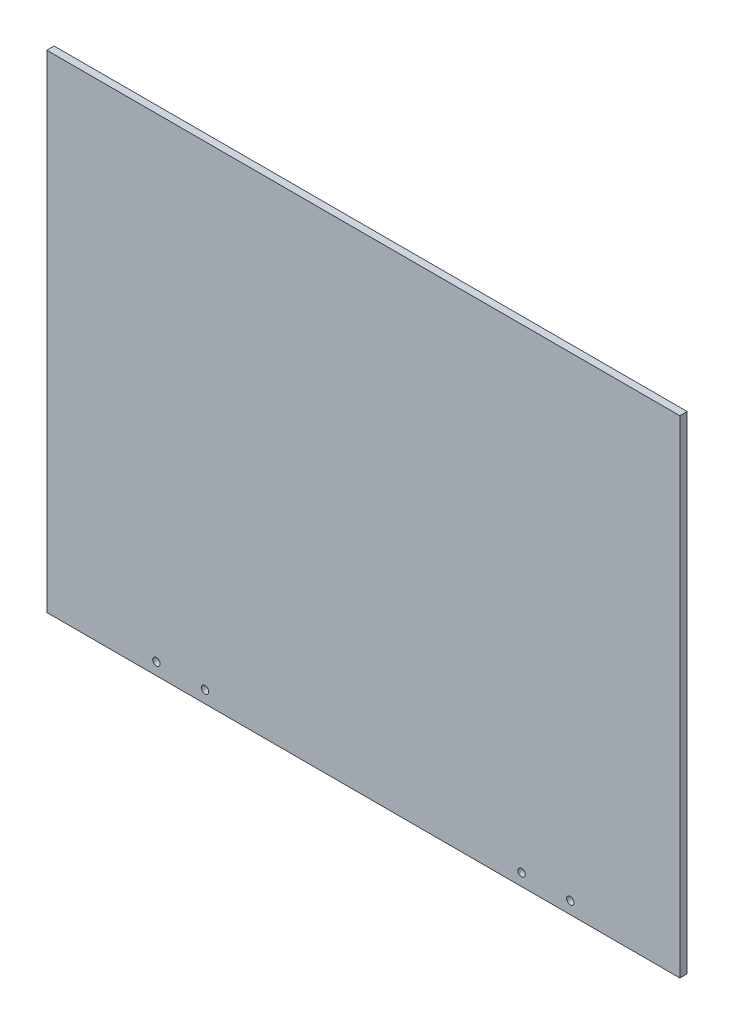
from build123d import *

# Parameters (mm, degrees)
SKETCH1_W               = 260
SKETCH1_H               = 200
BOSS_EXTRUDE1_DEPTH     = 3
CUT_EXTRUDE1_DEPTH      = 165.039629358
CUT_EXTRUDE1_DEPTH_BACK = 165.039629358
SKETCH2_R               = 1.5


with BuildPart() as part:
    # Sketch1 → Boss-Extrude1 (new body)
    with BuildSketch(Plane.XY):
        Rectangle(SKETCH1_W, SKETCH1_H)
    extrude(amount=BOSS_EXTRUDE1_DEPTH)

    # Sketch2 → Cut-Extrude1 (cut, two sides: drawn at the far end of the back side and taken through both)
    with BuildSketch(Plane.XY.offset(3).offset(-CUT_EXTRUDE1_DEPTH_BACK)):
        with Locations((-65, -95)):
            Circle(SKETCH2_R)
        with Locations((-85, -95)):
            Circle(SKETCH2_R)
        with Locations((85, -95)):
            Circle(SKETCH2_R)
        with Locations((65, -95)):
            Circle(SKETCH2_R)
    extrude(amount=CUT_EXTRUDE1_DEPTH + CUT_EXTRUDE1_DEPTH_BACK, mode=Mode.SUBTRACT)


solid = part.part
